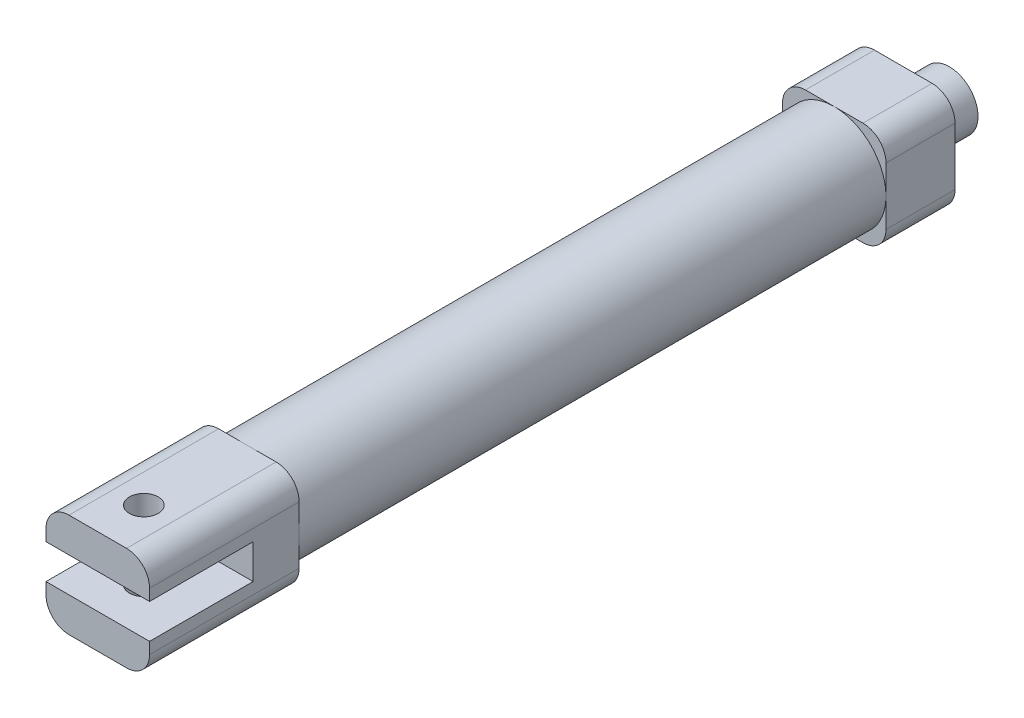
from build123d import *

# Parameters (mm, degrees)
SKETCH_1_R          = 9
SKETCH_1_R_2        = 8
EXTRUDE_1_DEPTH     = 102
EXTRUDE_2_DEPTH     = 26
EXTRUDE_START       = 12
EXTRUDE_3_DEPTH     = 12
SKETCH_4_R          = 5
EXTRUDE_4_DEPTH     = 8
SKETCH_5_R          = 2.5
CUT_EXTRUDE_1_DEPTH = 38
SKETCH_6_R          = 2
SKETCH_6_R_2        = 1.980516498
CUT_EXTRUDE_3_DEPTH = 3
SKETCH_7_W          = 18
SKETCH_7_H          = 6
CUT_EXTRUDE_4_DEPTH = 20
SKETCH_8_R          = 2.5
CUT_EXTRUDE_5_DEPTH = 20


with BuildPart() as part:
    # 草图1 → 凸台-拉伸1 (new body)
    with BuildSketch(Plane.XY):
        Circle(SKETCH_1_R)
        Circle(SKETCH_1_R_2, mode=Mode.SUBTRACT)
    extrude(amount=EXTRUDE_1_DEPTH)

    # 草图2 → 凸台-拉伸2 (add)
    with BuildSketch(Plane.XY.offset(102)):
        with BuildLine():
            Line((-5, -9), (5, -9))
            ThreePointArc((5, -9), (7.828427125, -7.828427125), (9, -5))
            Line((9, -5), (9, 5))
            ThreePointArc((9, 5), (7.828427125, 7.828427125), (5, 9))
            Line((5, 9), (-5, 9))
            ThreePointArc((-5, 9), (-7.828427125, 7.828427125), (-9, 5))
            Line((-9, 5), (-9, -5))
            ThreePointArc((-9, -5), (-7.828427125, -7.828427125), (-5, -9))
        make_face()
    extrude(amount=EXTRUDE_2_DEPTH)

    # 草图3 → 凸台-拉伸3 (add)
    with BuildSketch(Plane(origin=(0, 0, 0), x_dir=(-1, 0, 0), z_dir=(0, 0, -1)).offset(EXTRUDE_START)):
        with BuildLine():
            Line((-5, -9), (5, -9))
            ThreePointArc((5, -9), (7.828427125, -7.828427125), (9, -5))
            Line((9, -5), (9, 5))
            ThreePointArc((9, 5), (7.828427125, 7.828427125), (5, 9))
            Line((5, 9), (-5, 9))
            ThreePointArc((-5, 9), (-7.828427125, 7.828427125), (-9, 5))
            Line((-9, 5), (-9, -5))
            ThreePointArc((-9, -5), (-7.828427125, -7.828427125), (-5, -9))
        make_face()
    extrude(amount=-EXTRUDE_3_DEPTH)

    # 草图4 → 凸台-拉伸4 (add)
    with BuildSketch(Plane(origin=(0, 0, -12), x_dir=(-1, 0, 0), z_dir=(0, 0, -1))):
        Circle(SKETCH_4_R)
    extrude(amount=EXTRUDE_4_DEPTH)

    # 草图5 → 切除-拉伸1 (cut)
    with BuildSketch(Plane(origin=(0, 0, -20), x_dir=(-1, 0, 0), z_dir=(0, 0, -1))):
        Circle(SKETCH_5_R)
    extrude(amount=-CUT_EXTRUDE_1_DEPTH, mode=Mode.SUBTRACT)

    # 草图6 → 切除-拉伸3 (cut)
    with BuildSketch(Plane.ZY.offset(9)):
        with Locations((-4, 0)):
            Circle(SKETCH_6_R)
        with Locations((106, 0)):
            Circle(SKETCH_6_R_2)
    extrude(amount=-CUT_EXTRUDE_3_DEPTH, mode=Mode.SUBTRACT)

    # 草图7 → 切除-拉伸4 (cut)
    with BuildSketch(Plane.ZY.offset(9)):
        with Locations((119, 0)):
            Rectangle(SKETCH_7_W, SKETCH_7_H)
    extrude(amount=-CUT_EXTRUDE_4_DEPTH, mode=Mode.SUBTRACT)

    # 草图8 → 切除-拉伸5 (cut)
    with BuildSketch(Plane.XZ.offset(9)):
        with Locations(Location((0, 120, 0), (0, 0, 270))):
            Circle(SKETCH_8_R)
    extrude(amount=-CUT_EXTRUDE_5_DEPTH, mode=Mode.SUBTRACT)


solid = part.part
